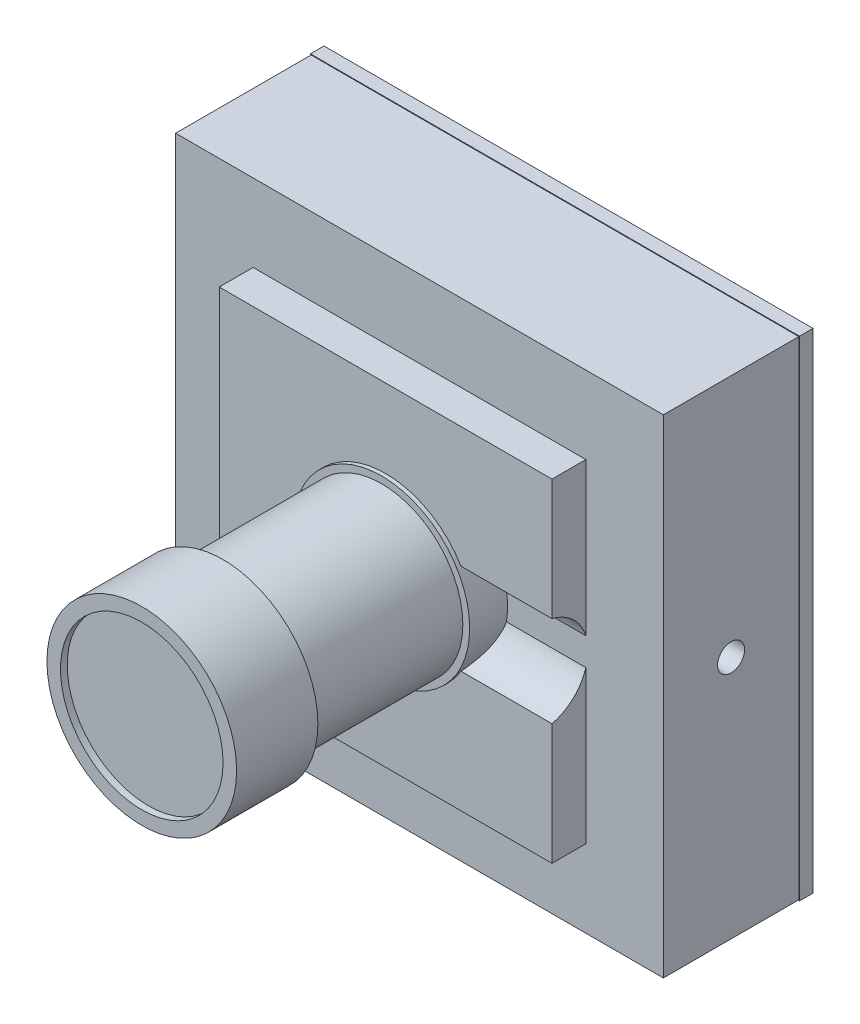
from build123d import *

# Parameters (mm, degrees)
SKETCH_1_W               = 36
SKETCH_1_H               = 36
EXTRUDE_1_DEPTH          = 10
SKETCH_2_W               = 24.56
SKETCH_2_H               = 24.56
EXTRUDE_2_DEPTH          = 2.5
SKETCH_3_R               = 6
EXTRUDE_3_DEPTH          = 12
SKETCH_4_R               = 7
EXTRUDE_4_DEPTH          = 6
CUT_EXTRUDE_START        = -0.5
SKETCH_5_R               = 6
CUT_EXTRUDE_1_DEPTH      = 0.5
SKETCH_7_R               = 6.5
EXTRUDE_5_DEPTH          = 0.3
CUT_EXTRUDE_2_REACH      = 48.595
CUT_EXTRUDE_2_END_RADIUS = 6.5
SKETCH_10_R              = 1
CUT_EXTRUDE_3_DEPTH      = 3
SKETCH_11_W              = 36.1
SKETCH_11_H              = 36.1
EXTRUDE_6_DEPTH          = 1
SKETCH_12_W              = 11
SKETCH_12_H              = 5
CUT_EXTRUDE_4_DEPTH      = 5


with BuildPart() as part:
    # 草图1 → 凸台-拉伸1 (new body)
    with BuildSketch(Plane.XY):
        Rectangle(SKETCH_1_W, SKETCH_1_H)
    extrude(amount=EXTRUDE_1_DEPTH)

    # 草图2 → 凸台-拉伸2 (add)
    with BuildSketch(Plane.XY.offset(10)):
        Rectangle(SKETCH_2_W, SKETCH_2_H)
    extrude(amount=EXTRUDE_2_DEPTH)

    # 草图3 → 凸台-拉伸3 (add)
    with BuildSketch(Plane.XY.offset(12.5)):
        Circle(SKETCH_3_R)
    extrude(amount=EXTRUDE_3_DEPTH)

    # 草图4 → 凸台-拉伸4 (add)
    with BuildSketch(Plane.XY.offset(24.5)):
        Circle(SKETCH_4_R)
    extrude(amount=EXTRUDE_4_DEPTH)

    # 草图5 → 切除-拉伸1 (cut)
    with BuildSketch(Plane.XY.offset(30.5).offset(CUT_EXTRUDE_START)):
        Circle(SKETCH_5_R)
    extrude(amount=CUT_EXTRUDE_1_DEPTH, mode=Mode.SUBTRACT)

    # 草图7 → 凸台-拉伸5 (add)
    with BuildSketch(Plane.XY.offset(12.5)):
        with Locations(Location((0, 0, 0), (0, 0, 180))):
            Circle(SKETCH_7_R)
    extrude(amount=EXTRUDE_5_DEPTH)

    # 切除-拉伸2: up to this cylinder (the profile starts outside it)
    cut_extrude_2_end = Plane(origin=(0, 0, 11.416503), z_dir=(0, 0, -1)) * Cylinder(CUT_EXTRUDE_2_END_RADIUS, 111.19, mode=Mode.PRIVATE)
    # 草图9 → 切除-拉伸2 (cut, up to the surface)
    with BuildSketch(Plane(origin=(12.28, 0, 0), x_dir=(0, 0, -1), z_dir=(1, 0, 0)), mode=Mode.PRIVATE) as cut_extrude_2_sk1:
        with BuildLine():
            Line((-10, -1.020232895), (-10, 1.020232895))
            ThreePointArc((-10, 1.020232895), (-10.939857211, 2.52041951), (-12.5, 3.35698746))
            Line((-12.5, 3.35698746), (-12.5, -3.35698746))
            ThreePointArc((-12.5, -3.35698746), (-10.939857211, -2.52041951), (-10, -1.020232895))
        make_face()
    cut_extrude_2_tool1 = extrude(cut_extrude_2_sk1.sketch, amount=-CUT_EXTRUDE_2_REACH, mode=Mode.PRIVATE) - cut_extrude_2_end
    add(cut_extrude_2_tool1.solids().sort_by_distance((12.28, 0, 11.416503))[0], mode=Mode.SUBTRACT)

    # 草图10 → 切除-拉伸3 (cut)
    with BuildSketch(Plane(origin=(18, 0, 0), x_dir=(0, 0, -1), z_dir=(1, 0, 0))):
        with Locations((-5, 0)):
            Circle(SKETCH_10_R)
    cut_extrude_3 = extrude(amount=-CUT_EXTRUDE_3_DEPTH, mode=Mode.SUBTRACT)

    # 镜向1: 切除-拉伸3 across plane
    add(cut_extrude_3.mirror(Plane(origin=(0, 0, 0), x_dir=(0, 0, 1), z_dir=(1, 0, 0))), mode=Mode.SUBTRACT)

    # 草图11 → 凸台-拉伸6 (add)
    with BuildSketch(Plane(origin=(0, 0, 0), x_dir=(-1, 0, 0), z_dir=(0, 0, -1))):
        Rectangle(SKETCH_11_W, SKETCH_11_H)
    extrude(amount=EXTRUDE_6_DEPTH)

    # 草图12 → 切除-拉伸4 (cut)
    with BuildSketch(Plane(origin=(0, 0, -1), x_dir=(-1, 0, 0), z_dir=(0, 0, -1))):
        with Locations((0, -13.05)):
            Rectangle(SKETCH_12_W, SKETCH_12_H)
    extrude(amount=-CUT_EXTRUDE_4_DEPTH, mode=Mode.SUBTRACT)


solid = part.part
